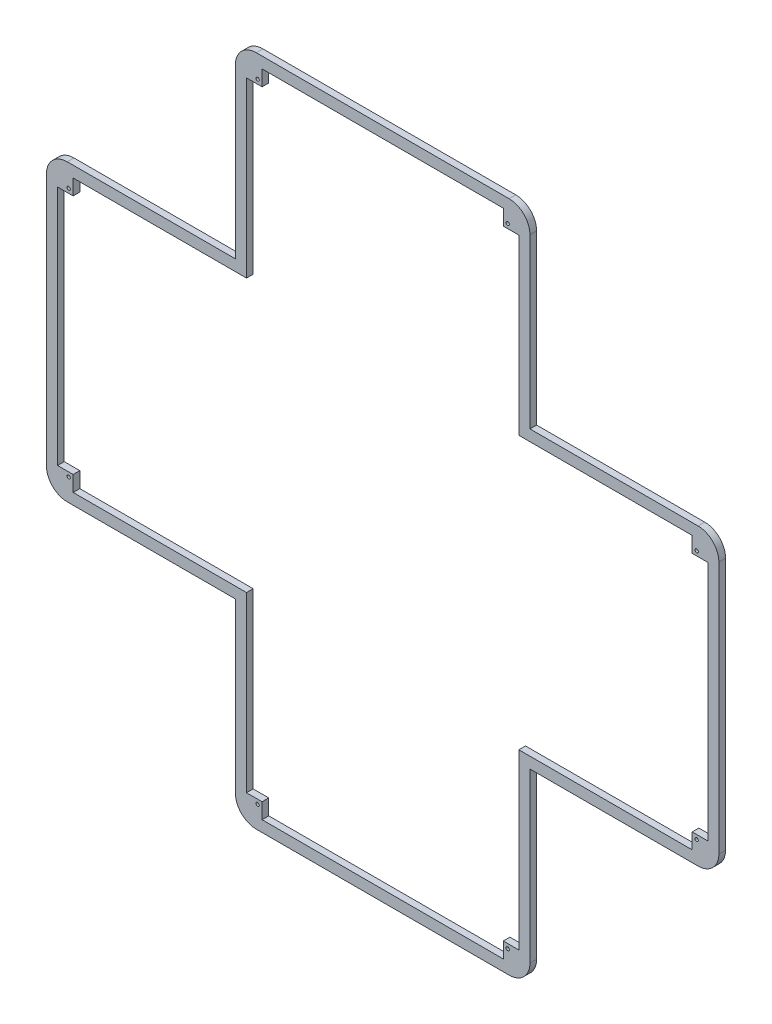
from build123d import *

# Parameters (mm, degrees)
CROQUIS1_R              = 1.5
SALIENTE_EXTRUIR1_DEPTH = 6


with BuildPart() as part:
    # Croquis1 → Saliente-Extruir1 (new body)
    with BuildSketch(Plane.XY):
        with BuildLine():
            Line((-283.764, 132.5), (-132.5, 132.5))
            Line((-132.5, 132.5), (-132.5, 283.764))
            ThreePointArc((-132.5, 283.764), (-127.012352652, 297.012352652), (-113.764, 302.5))
            Line((-113.764, 302.5), (113.764, 302.5))
            ThreePointArc((113.764, 302.5), (127.012352652, 297.012352652), (132.5, 283.764))
            Line((132.5, 283.764), (132.5, 132.5))
            Line((132.5, 132.5), (283.764, 132.5))
            ThreePointArc((283.764, 132.5), (297.012352652, 127.012352652), (302.5, 113.764))
            Line((302.5, 113.764), (302.5, -113.764))
            ThreePointArc((302.5, -113.764), (297.012352652, -127.012352652), (283.764, -132.5))
            Line((283.764, -132.5), (132.5, -132.5))
            Line((132.5, -132.5), (132.5, -283.764))
            ThreePointArc((132.5, -283.764), (127.012352652, -297.012352652), (113.764, -302.5))
            Line((113.764, -302.5), (-113.764, -302.5))
            ThreePointArc((-113.764, -302.5), (-127.012352652, -297.012352652), (-132.5, -283.764))
            Line((-132.5, -283.764), (-132.5, -132.5))
            Line((-132.5, -132.5), (-283.764, -132.5))
            ThreePointArc((-283.764, -132.5), (-297.012352652, -127.012352652), (-302.5, -113.764))
            Line((-302.5, -113.764), (-302.5, 113.764))
            ThreePointArc((-302.5, 113.764), (-297.012352652, 127.012352652), (-283.764, 132.5))
        make_face()
        with Locations((-282.5, 112.5)):
            Circle(CROQUIS1_R, mode=Mode.SUBTRACT)
        with Locations((-282.5, -112.5)):
            Circle(CROQUIS1_R, mode=Mode.SUBTRACT)
        with Locations((-112.5, -282.5)):
            Circle(CROQUIS1_R, mode=Mode.SUBTRACT)
        with Locations((112.5, -282.5)):
            Circle(CROQUIS1_R, mode=Mode.SUBTRACT)
        with Locations((282.5, -112.5)):
            Circle(CROQUIS1_R, mode=Mode.SUBTRACT)
        with Locations((282.5, 112.5)):
            Circle(CROQUIS1_R, mode=Mode.SUBTRACT)
        with Locations((-112.5, 282.5)):
            Circle(CROQUIS1_R, mode=Mode.SUBTRACT)
        with Locations((112.5, 282.5)):
            Circle(CROQUIS1_R, mode=Mode.SUBTRACT)
        Polygon((-278.5, 122.5), (-122.5, 122.5), (-122.5, 278.5), (-108.5, 278.5), (-108.5, 292.5), (108.5, 292.5), (108.5, 278.5), (122.5, 278.5), (122.5, 122.5), (278.5, 122.5), (278.5, 108.5), (292.5, 108.5), (292.5, -108.5), (278.5, -108.5), (278.5, -122.5), (122.5, -122.5), (122.5, -278.5), (108.5, -278.5), (108.5, -292.5), (-108.5, -292.5), (-108.5, -278.5), (-122.5, -278.5), (-122.5, -122.5), (-278.5, -122.5), (-278.5, -108.5), (-292.5, -108.5), (-292.5, 108.5), (-278.5, 108.5), align=None, mode=Mode.SUBTRACT)
    extrude(amount=SALIENTE_EXTRUIR1_DEPTH)


solid = part.part
